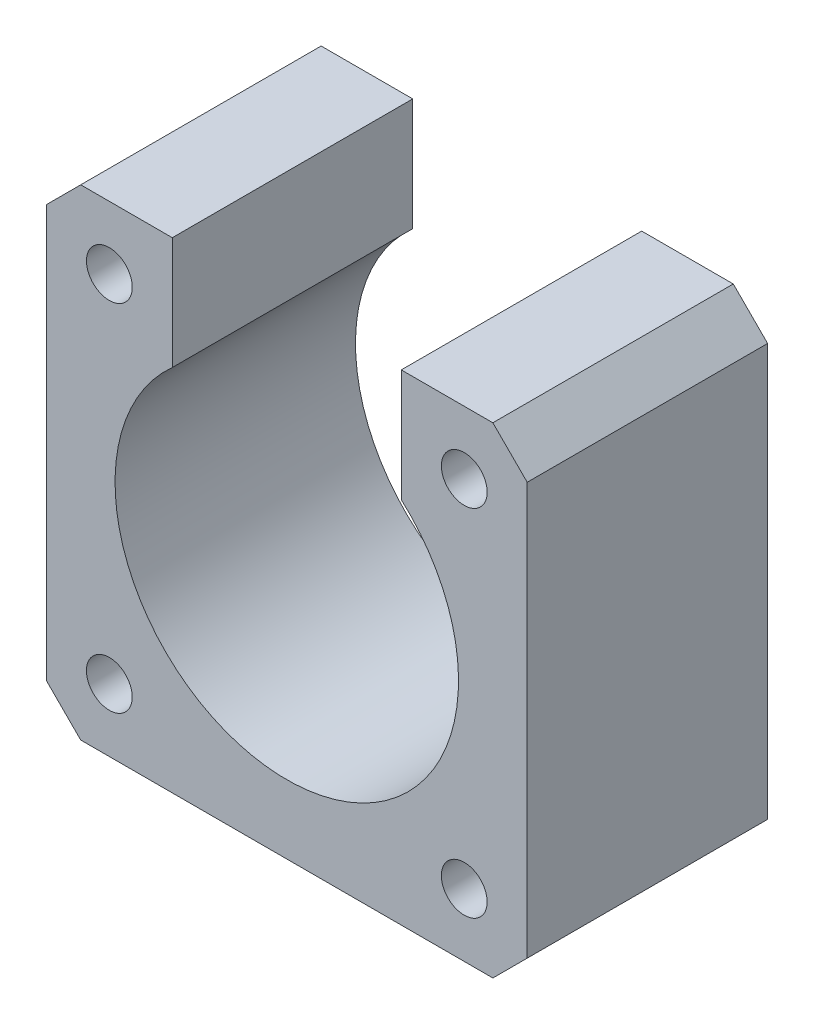
from build123d import *

# Parameters (mm, degrees)
SKETCH_1_R      = 2
EXTRUDE_1_DEPTH = 21


with BuildPart() as part:
    # 草图1 → 凸台-拉伸1 (new body)
    with BuildSketch(Plane.XY):
        with BuildLine():
            Line((-21, 18), (-18, 21))
            Line((-18, 21), (-10, 21))
            Line((-10, 21), (-10, 11.180339887))
            ThreePointArc((-10, 11.180339887), (0, -15), (10, 11.180339887))
            Line((10, 11.180339887), (10, 21))
            Line((10, 21), (18, 21))
            Line((18, 21), (21, 18))
            Line((21, 18), (21, -18))
            Line((21, -18), (18, -21))
            Line((18, -21), (-18, -21))
            Line((-18, -21), (-21, -18))
            Line((-21, -18), (-21, 18))
        make_face()
        with Locations(Location((15.5, 15.5, 0), (0, 0, 180))):
            Circle(SKETCH_1_R, mode=Mode.SUBTRACT)
        with Locations(Location((15.5, -15.5, 0), (0, 0, 180))):
            Circle(SKETCH_1_R, mode=Mode.SUBTRACT)
        with Locations(Location((-15.5, -15.5, 0), (0, 0, 180))):
            Circle(SKETCH_1_R, mode=Mode.SUBTRACT)
        with Locations(Location((-15.5, 15.5, 0), (0, 0, 180))):
            Circle(SKETCH_1_R, mode=Mode.SUBTRACT)
    extrude(amount=EXTRUDE_1_DEPTH)


solid = part.part
